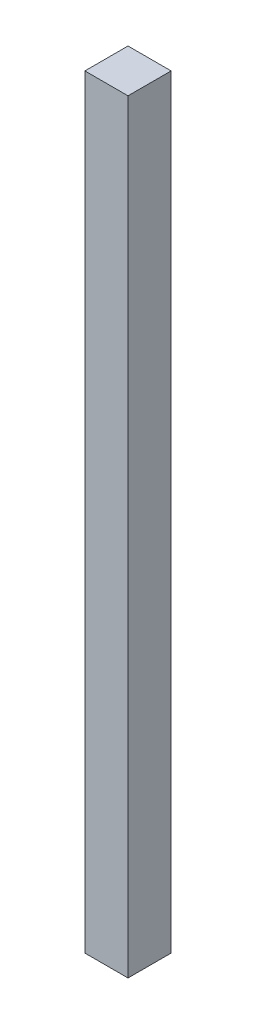
from build123d import *

# Parameters (mm, degrees)
SKETCH1_W           = 25.4
SKETCH1_H           = 25.4
BOSS_EXTRUDE1_DEPTH = 450


with BuildPart() as part:
    # Sketch1 → Boss-Extrude1 (new body)
    with BuildSketch(Plane(origin=(0, 0, 0), x_dir=(1, 0, 0), z_dir=(0, 1, 0))):
        with Locations((12.7, 12.7)):
            Rectangle(SKETCH1_W, SKETCH1_H)
    extrude(amount=BOSS_EXTRUDE1_DEPTH)


solid = part.part
